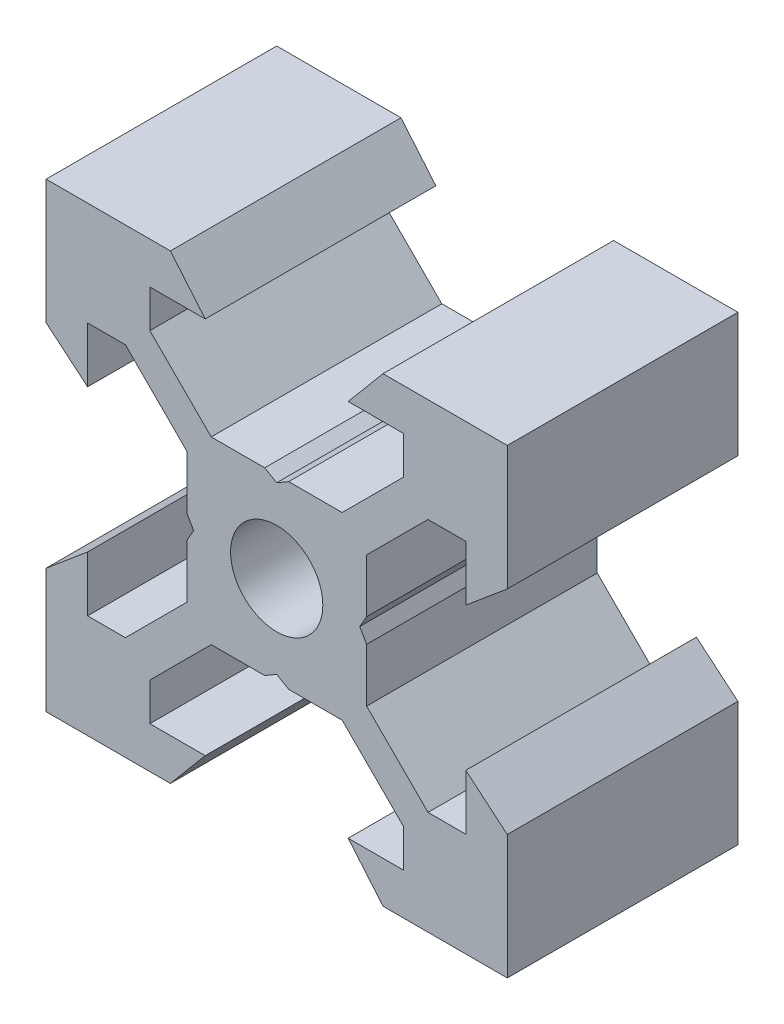
from build123d import *

# Parameters (mm, degrees)
SKETCH1_R           = 2
BOSS_EXTRUDE1_DEPTH = 5


with BuildPart() as part:
    # Sketch1 → Boss-Extrude1 (new, symmetric)
    with BuildSketch(Plane.XY):
        Polygon((10, 10), (10, 4.610379336), (8.2, 3.1), (8.2, 5.5), (6.560660172, 5.5), (3.9, 2.839339828), (3.9, 0.519615242), (3.6, 0), (3.9, -0.519615242), (3.9, -2.839339828), (6.560660172, -5.5), (8.2, -5.5), (8.2, -3.1), (10, -4.610379336), (10, -10), (4.610379336, -10), (3.1, -8.2), (5.5, -8.2), (5.5, -6.560660172), (2.839339828, -3.9), (0.519615242, -3.9), (0, -3.6), (-0.519615242, -3.9), (-2.839339828, -3.9), (-5.5, -6.560660172), (-5.5, -8.2), (-3.1, -8.2), (-4.610379336, -10), (-10, -10), (-10, -4.610379336), (-8.2, -3.1), (-8.2, -5.5), (-6.560660172, -5.5), (-3.9, -2.839339828), (-3.9, -0.519615242), (-3.6, 0), (-3.9, 0.519615242), (-3.9, 2.839339828), (-6.560660172, 5.5), (-8.2, 5.5), (-8.2, 3.1), (-10, 4.610379336), (-10, 10), (-4.610379336, 10), (-3.1, 8.2), (-5.5, 8.2), (-5.5, 6.560660172), (-2.839339828, 3.9), (-0.519615242, 3.9), (0, 3.6), (0.519615242, 3.9), (2.839339828, 3.9), (5.5, 6.560660172), (5.5, 8.2), (3.1, 8.2), (4.610379336, 10), align=None)
        Circle(SKETCH1_R, mode=Mode.SUBTRACT)
    extrude(amount=BOSS_EXTRUDE1_DEPTH, both=True)


solid = part.part
